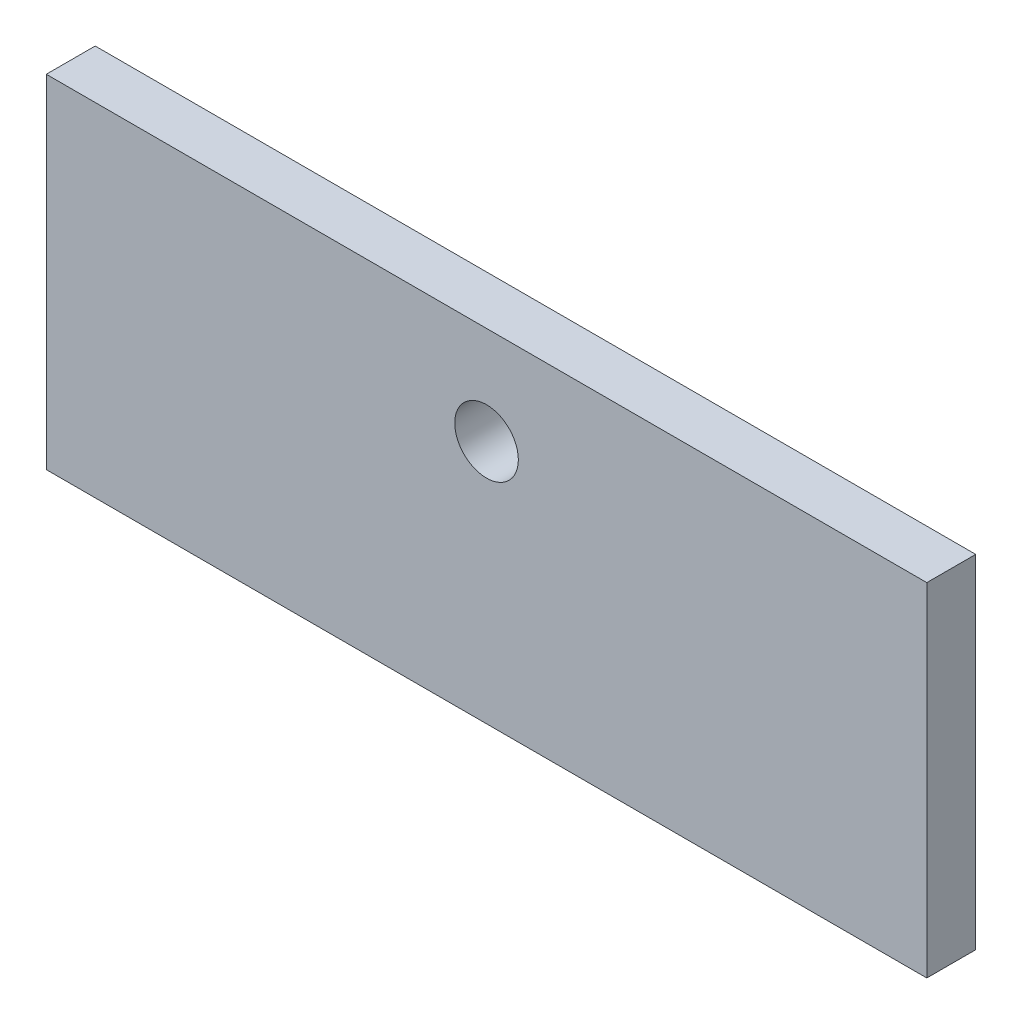
from build123d import *

# Parameters (mm, degrees)
SKETCH_1_W      = 90
SKETCH_1_H      = 35
SKETCH_1_R      = 3.25
EXTRUDE_1_DEPTH = 5


with BuildPart() as part:
    # 草图1 → 凸台-拉伸1 (new body)
    with BuildSketch(Plane.XY):
        with Locations((45, 17.5)):
            Rectangle(SKETCH_1_W, SKETCH_1_H)
        with Locations((45, 25)):
            Circle(SKETCH_1_R, mode=Mode.SUBTRACT)
    extrude(amount=EXTRUDE_1_DEPTH)


solid = part.part
